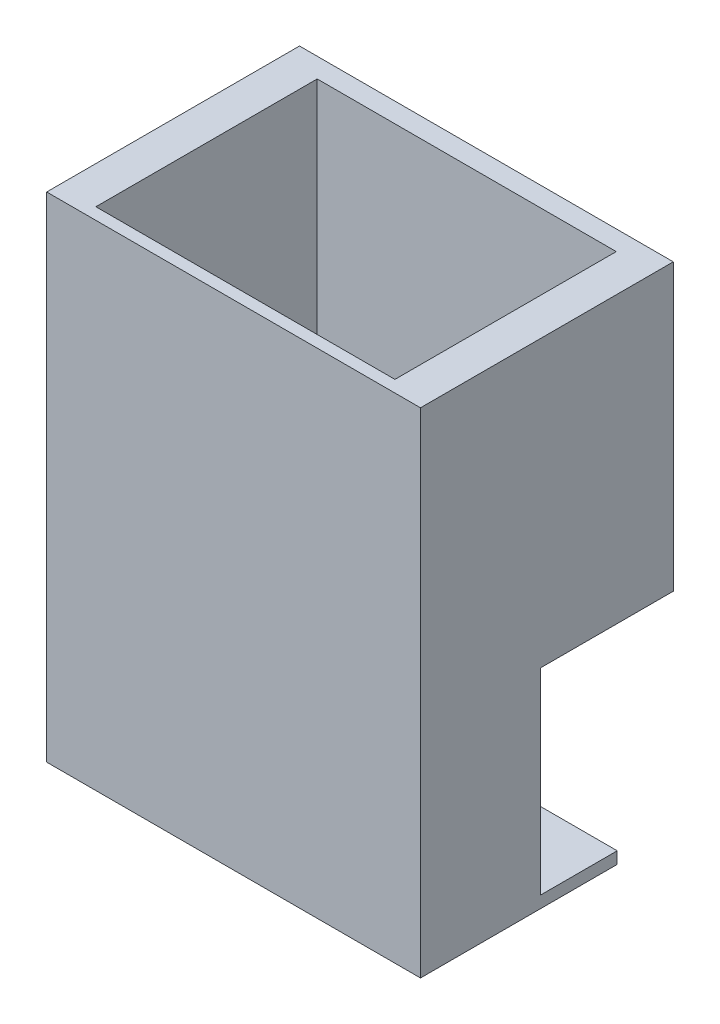
from build123d import *

# Parameters (mm, degrees)
SKETCH1_W           = 48.26
SKETCH1_H           = 25.4
BOSS_EXTRUDE1_DEPTH = 1.524
BOSS_EXTRUDE2_DEPTH = 36.83
SKETCH3_W           = 3.175
SKETCH3_H           = 3.175
BOSS_EXTRUDE3_DEPTH = 36.83
BOSS_EXTRUDE4_DEPTH = 3.175
SKETCH5_W           = 4.826
SKETCH5_H           = 11.43
BOSS_EXTRUDE5_DEPTH = 14.605
SKETCH7_W           = 2.54
SKETCH7_H           = 11.43
BOSS_EXTRUDE6_DEPTH = 48.26
SKETCH8_W           = 48.26
SKETCH8_H           = 32.639
SKETCH8_W_2         = 38.608
SKETCH8_H_2         = 28.575
BOSS_EXTRUDE7_DEPTH = 25.4


with BuildPart() as part:
    # Sketch1 → Boss-Extrude1 (new body)
    with BuildSketch(Plane(origin=(0, 0, 0), x_dir=(1, 0, 0), z_dir=(0, 1, 0))):
        with Locations((24.13, 12.7)):
            Rectangle(SKETCH1_W, SKETCH1_H)
    extrude(amount=BOSS_EXTRUDE1_DEPTH)

    # Sketch2 → Boss-Extrude2 (add)
    with BuildSketch(Plane(origin=(0, 1.524, 0), x_dir=(1, 0, 0), z_dir=(0, 1, 0))):
        Polygon((0, 15.494), (4.826, 15.494), (4.826, 1.524), (43.434, 1.524), (43.434, 15.494), (48.26, 15.494), (48.26, 0), (0, 0), align=None)
    extrude(amount=BOSS_EXTRUDE2_DEPTH)

    # Sketch3 → Boss-Extrude3 (add)
    with BuildSketch(Plane(origin=(0, 1.524, 0), x_dir=(1, 0, 0), z_dir=(0, 1, 0))):
        with Locations((6.4135, 13.9065)):
            Rectangle(SKETCH3_W, SKETCH3_H)
        with Locations((41.8465, 13.9065)):
            Rectangle(SKETCH3_W, SKETCH3_H)
    extrude(amount=BOSS_EXTRUDE3_DEPTH)

    # Sketch4 → Boss-Extrude4 (add)
    with BuildSketch(Plane(origin=(0, 0, -15.494), x_dir=(-1, 0, 0), z_dir=(0, 0, -1))):
        Polygon((-40.259, 38.354), (-36.195, 1.524), (-40.259, 1.524), align=None)
        Polygon((-8.001, 38.354), (-12.065, 1.524), (-8.001, 1.524), align=None)
    extrude(amount=-BOSS_EXTRUDE4_DEPTH)

    # Sketch5 → Boss-Extrude5 (add)
    with BuildSketch(Plane(origin=(0, 0, -15.494), x_dir=(-1, 0, 0), z_dir=(0, 0, -1))):
        with Locations((-45.847, 32.639)):
            Rectangle(SKETCH5_W, SKETCH5_H)
        with Locations((-2.413, 32.639)):
            Rectangle(SKETCH5_W, SKETCH5_H)
    extrude(amount=BOSS_EXTRUDE5_DEPTH)

    # Sketch7 → Boss-Extrude6 (add)
    with BuildSketch(Plane(origin=(48.26, 0, 0), x_dir=(0, 0, -1), z_dir=(1, 0, 0))):
        with Locations((31.369, 32.639)):
            Rectangle(SKETCH7_W, SKETCH7_H)
    extrude(amount=-BOSS_EXTRUDE6_DEPTH)

    # Sketch8 → Boss-Extrude7 (add)
    with BuildSketch(Plane(origin=(0, 38.354, 0), x_dir=(1, 0, 0), z_dir=(0, 1, 0))):
        with Locations((24.13, 16.3195)):
            Rectangle(SKETCH8_W, SKETCH8_H)
        with Locations((24.13, 15.8115)):
            Rectangle(SKETCH8_W_2, SKETCH8_H_2, mode=Mode.SUBTRACT)
    extrude(amount=BOSS_EXTRUDE7_DEPTH)


solid = part.part
